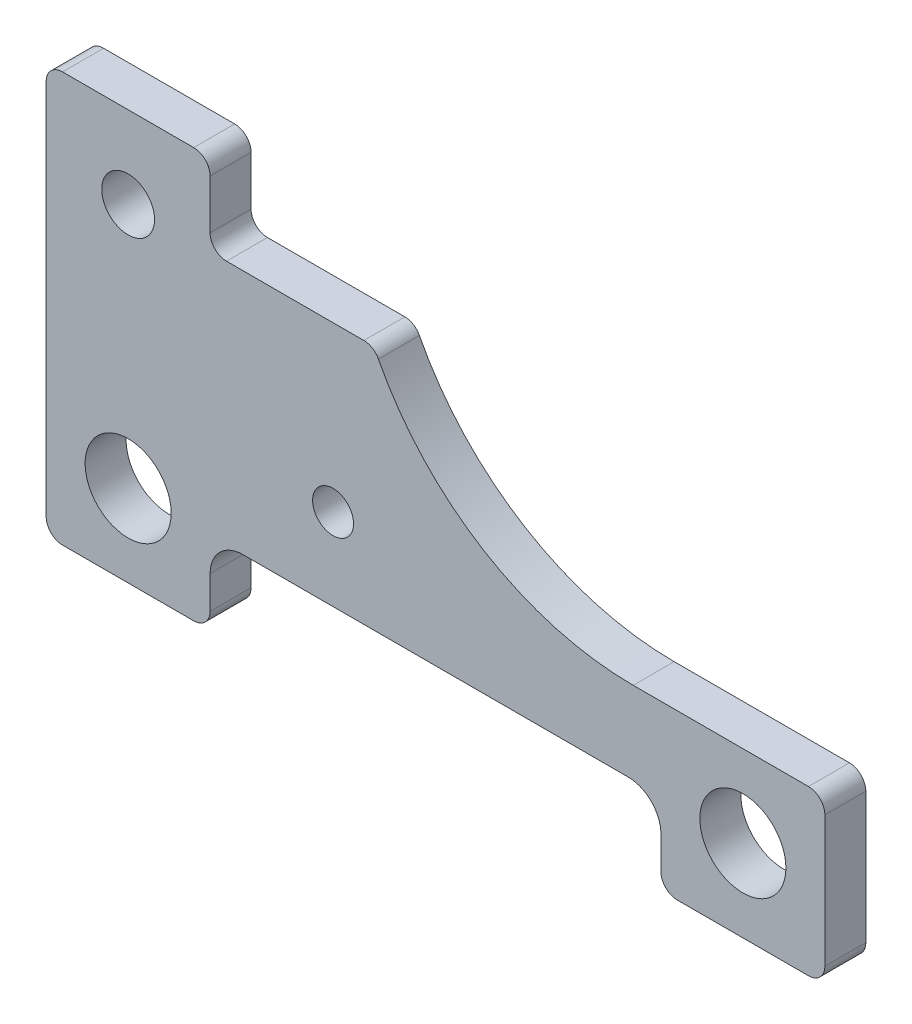
from build123d import *

# Parameters (mm, degrees)
SKETCH1_R           = 5.25
SKETCH1_R_2         = 3.225
SKETCH1_R_3         = 2.5
BOSS_EXTRUDE1_DEPTH = 2.5
FILLET1_R           = 4
FILLET3_R           = 2


with BuildPart() as part:
    # Sketch1 → Boss-Extrude1 (new, symmetric)
    with BuildSketch(Plane.XY):
        with BuildLine():
            Line((-47.5, 0), (-47.5, 50))
            Line((-47.5, 50), (-27.5, 50))
            Line((-27.5, 50), (-27.5, 40))
            Line((-27.5, 40), (-7.5, 40))
            ThreePointArc((-7.5, 40), (5.414502852, 25.418195989), (24.123722991, 19.998004673))
            Line((24.123722991, 19.998004673), (47.5, 19.998004673))
            Line((47.5, 19.998004673), (47.5, -0.001995327))
            Line((47.5, -0.001995327), (27.5, -0.001995327))
            Line((27.5, -0.001995327), (27.5, 10))
            Line((27.5, 10), (-27.5, 10))
            Line((-27.5, 10), (-27.5, 0))
            Line((-27.5, 0), (-47.5, 0))
        make_face()
        with Locations((-37.5, 10)):
            Circle(SKETCH1_R, mode=Mode.SUBTRACT)
        with Locations((-37.5, 40)):
            Circle(SKETCH1_R_2, mode=Mode.SUBTRACT)
        with Locations((-12.5, 20)):
            Circle(SKETCH1_R_3, mode=Mode.SUBTRACT)
        with Locations((37.5, 9.998004673)):
            Circle(SKETCH1_R, mode=Mode.SUBTRACT)
    extrude(amount=BOSS_EXTRUDE1_DEPTH, both=True)

    # Fillet1
    fillet1_edges = [part.edges().sort_by_distance(p)[0] for p in [
        (27.5, 10, 0),
        (-27.5, 10, 0),
    ]]
    fillet(fillet1_edges, radius=FILLET1_R)

    # Fillet3
    fillet3_edges = [part.edges().sort_by_distance(p)[0] for p in [
        (-47.5, 0, 0),
        (-47.5, 50, 0),
        (-27.5, 50, 0),
        (-27.5, 40, 0),
        (-7.5, 40, 0),
        (47.5, 19.998004673, 0),
        (47.5, -0.001995327, 0),
        (27.5, -0.001995327, 0),
        (-27.5, 0, 0),
    ]]
    fillet(fillet3_edges, radius=FILLET3_R)


solid = part.part
